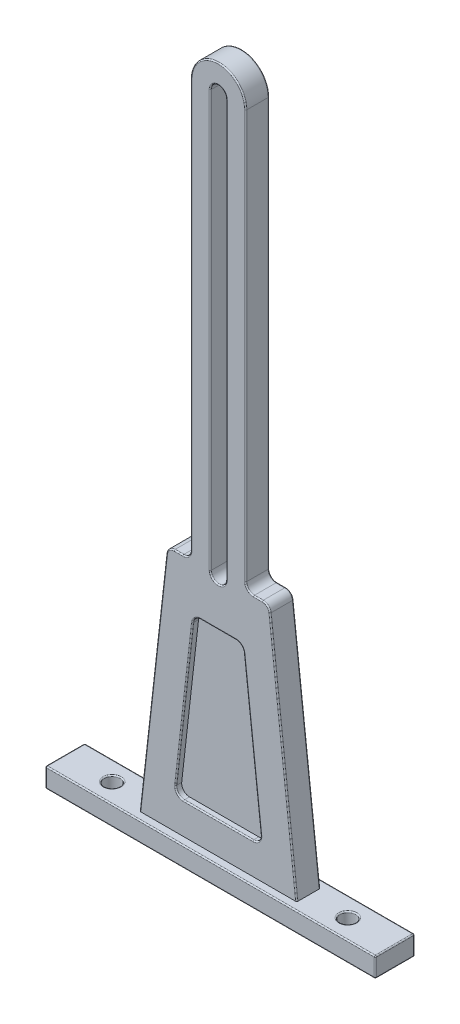
from build123d import *

# Parameters (mm, degrees)
BOSS_EXTRUDE1_DEPTH = 3
BOSS_EXTRUDE2_DEPTH = 3
SKETCH3_R           = 1
CUT_EXTRUDE1_DEPTH  = 2.5
SKETCH4_W           = 42
SKETCH4_H           = 5
SKETCH4_R           = 1
BOSS_EXTRUDE3_DEPTH = 2.5
FILLET1_R           = 1
CUT_EXTRUDE2_DEPTH  = 0.75
CUT_EXTRUDE3_DEPTH  = 0.75
FILLET2_R           = 1
FILLET3_R           = 0.15


with BuildPart() as part:
    # Sketch1 → Boss-Extrude1 (new body)
    with BuildSketch(Plane.XY):
        with BuildLine():
            Line((-3.5, 33.5), (-3.5, 86.5))
            ThreePointArc((-3.5, 86.5), (0, 90), (3.5, 86.5))
            Line((3.5, 86.5), (3.5, 33.5))
            ThreePointArc((3.5, 33.5), (0, 30), (-3.5, 33.5))
        make_face()
        with BuildLine():
            Line((-1, 33.5), (-1, 86.5))
            ThreePointArc((-1, 86.5), (0, 87.5), (1, 86.5))
            Line((1, 86.5), (1, 33.5))
            ThreePointArc((1, 33.5), (0, 32.5), (-1, 33.5))
        make_face(mode=Mode.SUBTRACT)
    extrude(amount=-BOSS_EXTRUDE1_DEPTH)

    # Sketch2 → Boss-Extrude2 (add)
    with BuildSketch(Plane.XY):
        with BuildLine():
            Line((-20, 0), (20, 0))
            Line((20, 0), (20, 2.5))
            Line((20, 2.5), (10, 2.5))
            Line((10, 2.5), (6.5, 33.5))
            Line((6.5, 33.5), (3.5, 33.5))
            ThreePointArc((3.5, 33.5), (0, 30), (-3.5, 33.5))
            Line((-3.5, 33.5), (-6.5, 33.5))
            Line((-6.5, 33.5), (-10, 2.5))
            Line((-10, 2.5), (-20, 2.5))
            Line((-20, 2.5), (-20, 0))
        make_face()
    extrude(amount=-BOSS_EXTRUDE2_DEPTH)

    # Sketch3 → Cut-Extrude1 (cut)
    with BuildSketch(Plane(origin=(0, 0, 0), x_dir=(1, 0, 0), z_dir=(0, 1, 0))):
        with Locations(Location((15, 1.5, 0), (0, 0, 180))):
            Circle(SKETCH3_R)
        with Locations(Location((-15, 1.5, 0), (0, 0, 90))):
            Circle(SKETCH3_R)
    extrude(amount=CUT_EXTRUDE1_DEPTH, mode=Mode.SUBTRACT)

    # Sketch4 → Boss-Extrude3 (add)
    with BuildSketch(Plane(origin=(0, 0, 0), x_dir=(1, 0, 0), z_dir=(0, 1, 0))):
        with Locations((0, 1.5)):
            Rectangle(SKETCH4_W, SKETCH4_H)
        with Locations(Location((15, 1.5, 0), (0, 0, 180))):
            Circle(SKETCH4_R, mode=Mode.SUBTRACT)
        with Locations(Location((-15, 1.5, 0), (0, 0, 90))):
            Circle(SKETCH4_R, mode=Mode.SUBTRACT)
    extrude(amount=BOSS_EXTRUDE3_DEPTH)

    # Fillet1
    fillet1_edges = [part.edges().sort_by_distance(p)[0] for p in [
        (-6.5, 33.5, -1.5),
        (6.5, 33.5, -1.5),
        (-3.5, 33.5, -1.5),
        (3.5, 33.5, -1.5),
    ]]
    fillet(fillet1_edges, radius=FILLET1_R)

    # Sketch5 → Cut-Extrude2 (cut)
    with BuildSketch(Plane.XY):
        Polygon((-5.522973551, 6.5), (5.522973551, 6.5), (3.152005809, 27.5), (-3.152005809, 27.5), align=None)
    extrude(amount=-CUT_EXTRUDE2_DEPTH, mode=Mode.SUBTRACT)

    # Sketch6 → Cut-Extrude3 (cut)
    with BuildSketch(Plane(origin=(0, 0, -3), x_dir=(-1, 0, 0), z_dir=(0, 0, -1))):
        Polygon((-5.522973551, 6.5), (5.522973551, 6.5), (3.152005809, 27.5), (-3.152005809, 27.5), align=None)
    extrude(amount=-CUT_EXTRUDE3_DEPTH, mode=Mode.SUBTRACT)

    # Fillet2
    fillet2_edges = [part.edges().sort_by_distance(p)[0] for p in [
        (-5.522973551, 6.5, -0.375),
        (-3.152005809, 27.5, -0.375),
        (3.152005809, 27.5, -0.375),
        (5.522973551, 6.5, -0.375),
        (5.522973551, 6.5, -2.625),
        (3.152005809, 27.5, -2.625),
        (-3.152005809, 27.5, -2.625),
        (-5.522973551, 6.5, -2.625),
    ]]
    fillet(fillet2_edges, radius=FILLET2_R)

    # Fillet3
    fillet3_edges = [part.edges().sort_by_distance(p)[0] for p in [
        (-3.792893219, 33.792893219, -3),
        (0, 90, -3),
        (4.324823018, 17.112190437, -3),
        (0, 27.5, -3),
        (0, 32.5, -3),
        (-4.324823018, 17.112190437, -3),
        (0, 6.5, -3),
        (-1, 60, -3),
        (-4.324823018, 17.112190437, 0),
        (0, 27.5, 0),
        (0, 87.5, -3),
        (1, 60, -3),
        (4.324823018, 17.112190437, 0),
        (0, 6.5, 0),
        (2.924817445, 27.245717921, -3),
        (0, 32.5, 0),
        (-2.924817445, 27.245717921, -3),
        (-3.5, 60.5, -3),
        (5.14943486, 6.833738203, -3),
        (-5.14943486, 6.833738203, -3),
        (-2.924817445, 27.245717921, 0),
        (2.924817445, 27.245717921, 0),
        (1, 60, 0),
        (5.14943486, 6.833738203, 0),
        (-5.14943486, 6.833738203, 0),
        (0, 87.5, 0),
        (-1, 60, 0),
        (8.300118282, 17.556095218, 0),
        (-8.300118282, 17.556095218, -3),
        (-3.5, 60.5, 0),
        (0, 90, 0),
        (16, 0, -1.5),
        (16, 2.5, -1.5),
        (-15, 0, -0.5),
        (-15, 2.5, -0.5),
        (0, 2.5, -4),
        (-21, 2.5, -1.5),
        (0, 2.5, 1),
        (21, 2.5, -1.5),
        (21, 1.25, -4),
        (0, 0, -4),
        (21, 1.25, 1),
        (21, 0, -1.5),
        (-21, 1.25, 1),
        (0, 0, 1),
        (-21, 1.25, -4),
        (-21, 0, -1.5),
        (5.05327492, 33.5, -3),
        (5.05327492, 33.5, 0),
        (3.5, 60.5, 0),
        (3.5, 60.5, -3),
        (8.300118282, 17.556095218, -3),
        (-5.05327492, 33.5, 0),
        (-8.300118282, 17.556095218, 0),
        (-6.272811636, 33.245717921, 0),
        (6.272811636, 33.245717921, 0),
        (-5.05327492, 33.5, -3),
        (-6.272811636, 33.245717921, -3),
        (6.272811636, 33.245717921, -3),
        (3.792893219, 33.792893219, 0),
        (3.792893219, 33.792893219, -3),
        (-3.792893219, 33.792893219, 0),
    ]]
    fillet(fillet3_edges, radius=FILLET3_R)


solid = part.part
